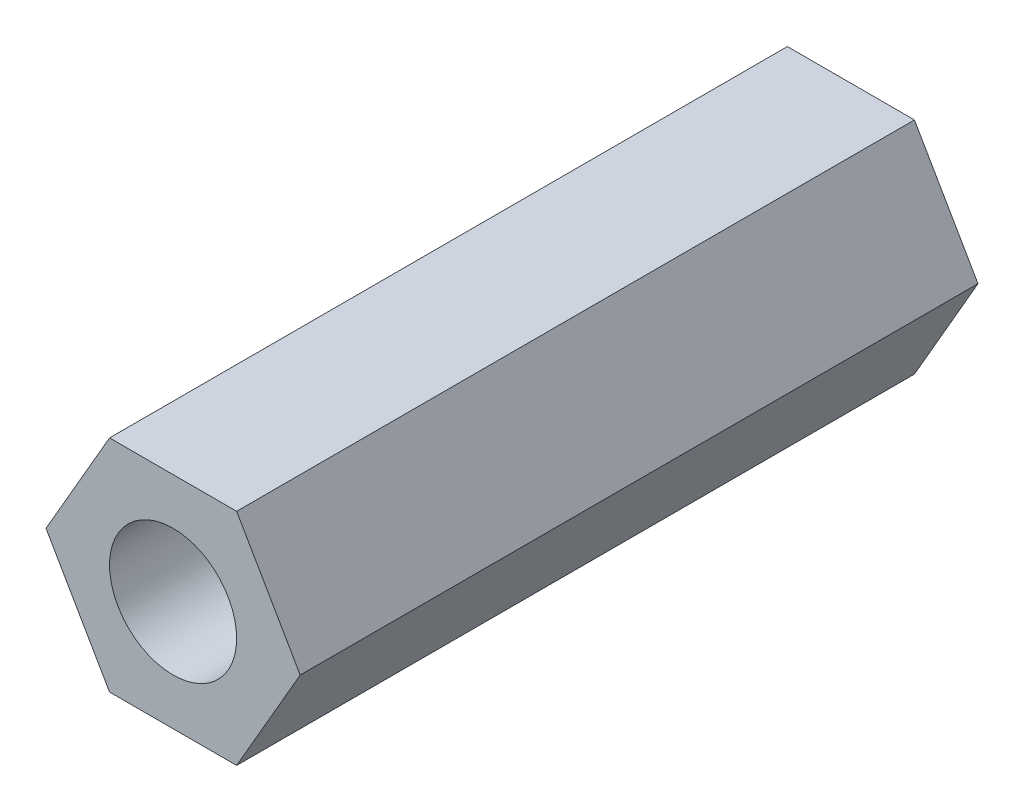
from build123d import *

# Parameters (mm, degrees)
CROQUIS1_R              = 1.5
SALIENTE_EXTRUIR1_DEPTH = 16


with BuildPart() as part:
    # Croquis1 → Saliente-Extruir1 (new body)
    with BuildSketch(Plane.XY):
        Polygon((1.500308251, 2.597898218), (-1.499691728, 2.598254168), (-2.999999979, 0.000355949), (-1.500308251, -2.597898218), (1.499691728, -2.598254168), (2.999999979, -0.000355949), align=None)
        Circle(CROQUIS1_R, mode=Mode.SUBTRACT)
    extrude(amount=SALIENTE_EXTRUIR1_DEPTH)


solid = part.part
